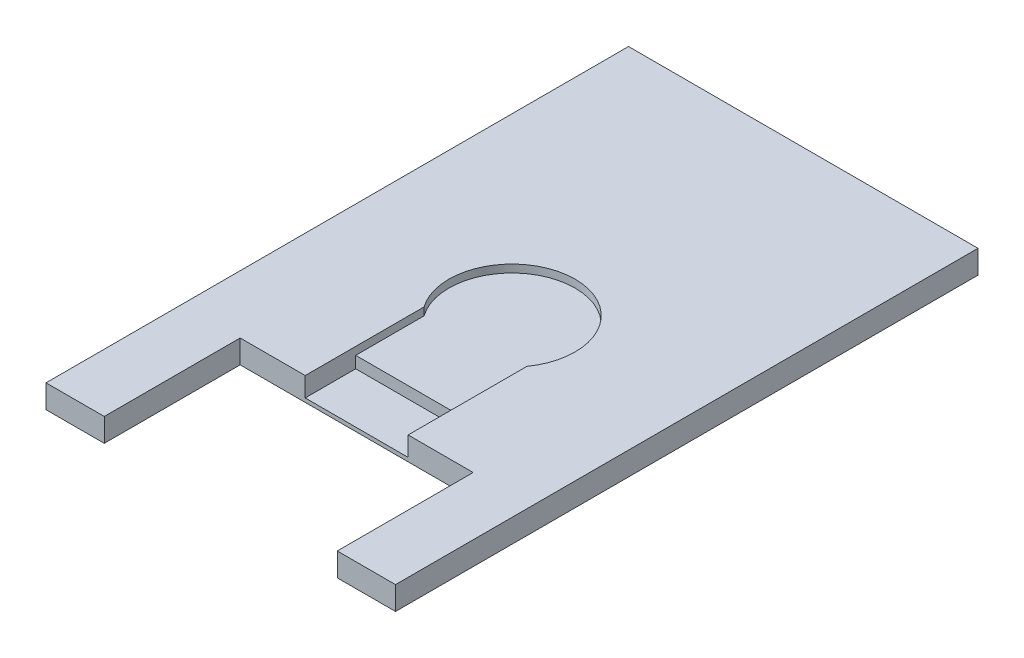
from build123d import *

# Parameters (mm, degrees)
SKETCH1_W           = 22.86
SKETCH1_H           = 38.1
BOSS_EXTRUDE1_DEPTH = 1.524
SKETCH2_W           = 14.986
SKETCH2_H           = 23.876
SKETCH2_W_2         = 13.716
SKETCH2_H_2         = 22.479
BOSS_EXTRUDE2_DEPTH = 2.032
CUT_EXTRUDE2_DEPTH  = 0.508
CUT_EXTRUDE3_START  = 0.508
SKETCH6_W           = 15.24
SKETCH6_H           = 8.89
CUT_EXTRUDE3_DEPTH  = 35.245345025
SKETCH7_W           = 6.731
SKETCH7_H           = 3.302
CUT_EXTRUDE4_DEPTH  = 0.762


with BuildPart() as part:
    # Sketch1 → Boss-Extrude1 (new body)
    with BuildSketch(Plane(origin=(0, 0, 0), x_dir=(1, 0, 0), z_dir=(0, 1, 0))):
        with Locations((6.342648046, -9.464051393)):
            Rectangle(SKETCH1_W, SKETCH1_H)
    extrude(amount=BOSS_EXTRUDE1_DEPTH)

    # Sketch2 → Boss-Extrude2 (add)
    with BuildSketch(Plane.XZ):
        with Locations((6.342648046, 5.019051393)):
            Rectangle(SKETCH2_W, SKETCH2_H)
        with Locations((6.342648046, 5.082551393)):
            Rectangle(SKETCH2_W_2, SKETCH2_H_2, mode=Mode.SUBTRACT)
    extrude(amount=BOSS_EXTRUDE2_DEPTH)

    # Sketch5 → Cut-Extrude2 (cut)
    with BuildSketch(Plane(origin=(0, 1.524, 0), x_dir=(1, 0, 0), z_dir=(0, 1, 0))):
        with BuildLine():
            ThreePointArc((10.470148046, -9.464051393), (5.088623524, -5.531662964), (2.977148046, -11.853542133))
            Line((2.977148046, -11.853542133), (9.708148046, -11.853542133))
            ThreePointArc((9.708148046, -11.853542133), (10.275036474, -10.718075914), (10.470148046, -9.464051393))
        make_face()
        with BuildLine():
            Line((9.708148046, -11.853542133), (2.977148046, -11.853542133))
            ThreePointArc((2.977148046, -11.853542133), (6.342648046, -13.591551393), (9.708148046, -11.853542133))
        make_face()
        with BuildLine():
            ThreePointArc((9.708148046, -11.853542133), (6.342648046, -13.591551393), (2.977148046, -11.853542133))
            Line((2.977148046, -11.853542133), (2.977148046, -28.514051393))
            Line((2.977148046, -28.514051393), (9.708148046, -28.514051393))
            Line((9.708148046, -28.514051393), (9.708148046, -11.853542133))
        make_face()
    extrude(amount=-CUT_EXTRUDE2_DEPTH, mode=Mode.SUBTRACT)

    # Sketch6 → Cut-Extrude3 (cut, through all)
    with BuildSketch(Plane(origin=(0, 1.016, 0), x_dir=(1, 0, 0), z_dir=(0, 1, 0)).offset(CUT_EXTRUDE3_START)):
        with Locations((6.342648046, -24.069051393)):
            Rectangle(SKETCH6_W, SKETCH6_H)
    extrude(amount=-CUT_EXTRUDE3_DEPTH, mode=Mode.SUBTRACT)

    # Sketch7 → Cut-Extrude4 (cut)
    with BuildSketch(Plane(origin=(0, 1.016, 0), x_dir=(1, 0, 0), z_dir=(0, 1, 0))):
        with Locations((6.342648046, -17.973051393)):
            Rectangle(SKETCH7_W, SKETCH7_H)
    extrude(amount=-CUT_EXTRUDE4_DEPTH, mode=Mode.SUBTRACT)


solid = part.part
